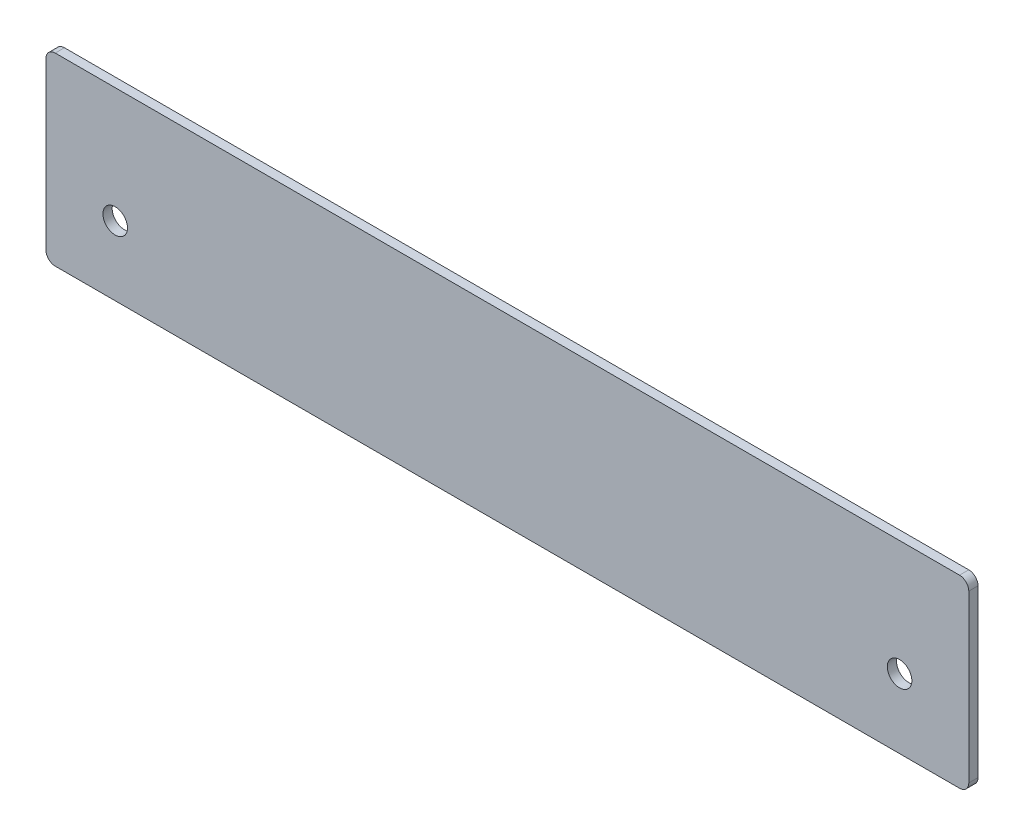
from build123d import *

# Parameters (mm, degrees)
BOSS_EXTRUDE1_DEPTH = 2.54
SKETCH3_R           = 3.3782
CUT_EXTRUDE1_DEPTH  = 130.54
SKETCH4_R           = 3.3782
CUT_EXTRUDE2_DEPTH  = 130.54


with BuildPart() as part:
    # Sketch2 → Boss-Extrude1 (new body)
    with BuildSketch(Plane.XY):
        with BuildLine():
            Line((-124.46, 25.4), (124.46, 25.4))
            ThreePointArc((124.46, 25.4), (126.256051224, 24.656051224), (127, 22.86))
            Line((127, 22.86), (127, -22.86))
            ThreePointArc((127, -22.86), (126.256051224, -24.656051224), (124.46, -25.4))
            Line((124.46, -25.4), (-124.46, -25.4))
            ThreePointArc((-124.46, -25.4), (-126.256051224, -24.656051224), (-127, -22.86))
            Line((-127, -22.86), (-127, 22.86))
            ThreePointArc((-127, 22.86), (-126.256051224, 24.656051224), (-124.46, 25.4))
        make_face()
    extrude(amount=BOSS_EXTRUDE1_DEPTH)

    # Sketch3 → Cut-Extrude1 (cut, through all)
    with BuildSketch(Plane.XY.offset(2.54)):
        with Locations((-107.95, -6.35)):
            Circle(SKETCH3_R)
    extrude(amount=-CUT_EXTRUDE1_DEPTH, mode=Mode.SUBTRACT)

    # Sketch4 → Cut-Extrude2 (cut, through all)
    with BuildSketch(Plane.XY.offset(2.54)):
        with Locations((107.95, -6.35)):
            Circle(SKETCH4_R)
    extrude(amount=-CUT_EXTRUDE2_DEPTH, mode=Mode.SUBTRACT)


solid = part.part
